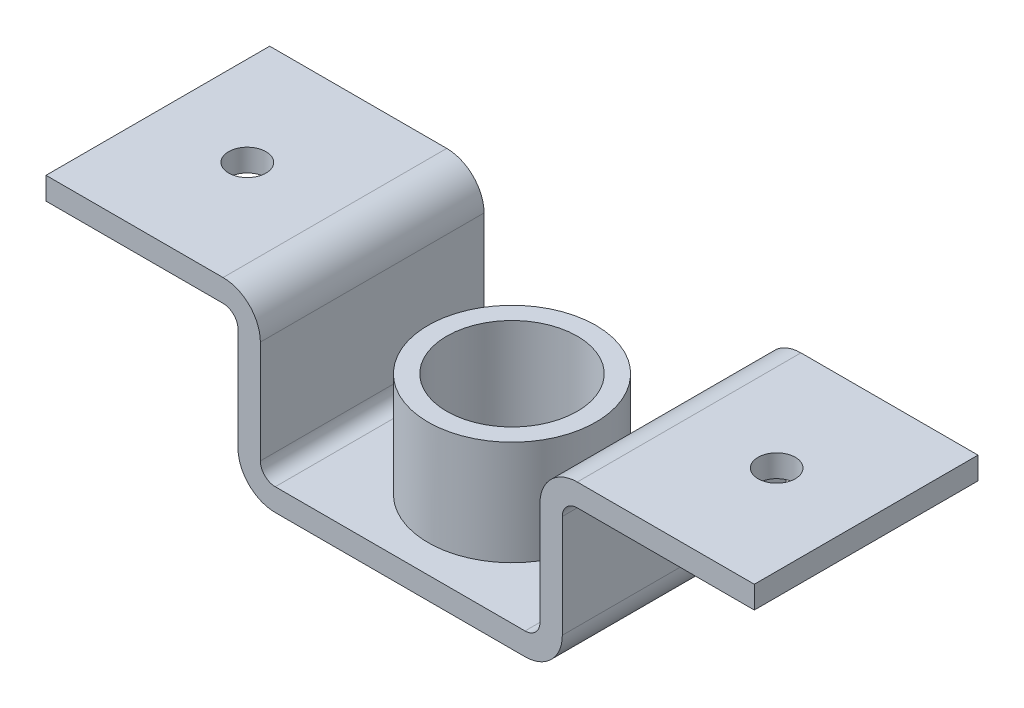
from build123d import *

# Parameters (mm, degrees)
BOSS_EXTRUDE2_DEPTH = 300
SKETCH3_R           = 112.5
SKETCH3_R_2         = 87.5
BOSS_EXTRUDE3_DEPTH = 170
SKETCH3_3_R         = 25
CUT_EXTRUDE1_DEPTH  = 238
SKETCH3_4_R         = 25
CUT_EXTRUDE2_DEPTH  = 238
SKETCH3_6_R         = 37.5
CUT_EXTRUDE4_DEPTH  = 30


with BuildPart() as part:
    # Sketch1 → Boss-Extrude2 (new body)
    with BuildSketch(Plane.XY):
        with BuildLine():
            Line((167.5, 0), (-167.5, 0))
            ThreePointArc((-167.5, 0), (-202.855339059, 14.644660941), (-217.5, 50))
            Line((-217.5, 50), (-217.5, 188))
            ThreePointArc((-217.5, 188), (-223.357864376, 202.142135624), (-237.5, 208))
            Line((-237.5, 208), (-475, 208))
            Line((-475, 208), (-475, 238))
            Line((-475, 238), (-237.5, 238))
            ThreePointArc((-237.5, 238), (-202.144660941, 223.355339059), (-187.5, 188))
            Line((-187.5, 188), (-187.5, 50))
            ThreePointArc((-187.5, 50), (-181.642135624, 35.857864376), (-167.5, 30))
            Line((-167.5, 30), (167.5, 30))
            ThreePointArc((167.5, 30), (181.642135624, 35.857864376), (187.5, 50))
            Line((187.5, 50), (187.5, 188))
            ThreePointArc((187.5, 188), (202.144660941, 223.355339059), (237.5, 238))
            Line((237.5, 238), (475, 238))
            Line((475, 238), (475, 208))
            Line((475, 208), (237.5, 208))
            ThreePointArc((237.5, 208), (223.357864376, 202.142135624), (217.5, 188))
            Line((217.5, 188), (217.5, 50))
            ThreePointArc((217.5, 50), (202.855339059, 14.644660941), (167.5, 0))
        make_face()
    extrude(amount=BOSS_EXTRUDE2_DEPTH)

    # Sketch3 → Boss-Extrude3 (add)
    with BuildSketch(Plane(origin=(0, 0, 0), x_dir=(1, 0, 0), z_dir=(0, 1, 0))):
        with Locations(Location((0, -150, 0), (0, 0, 90))):
            Circle(SKETCH3_R)
        with Locations(Location((0, -150, 0), (0, 0, 90))):
            Circle(SKETCH3_R_2, mode=Mode.SUBTRACT)
    extrude(amount=BOSS_EXTRUDE3_DEPTH)

    # Sketch3<3> → Cut-Extrude1 (cut)
    with BuildSketch(Plane(origin=(0, 0, 0), x_dir=(1, 0, 0), z_dir=(0, 1, 0))):
        with Locations(Location((-355, -150, 0), (0, 0, 90))):
            Circle(SKETCH3_3_R)
    extrude(amount=CUT_EXTRUDE1_DEPTH, mode=Mode.SUBTRACT)

    # Sketch3<4> → Cut-Extrude2 (cut)
    with BuildSketch(Plane(origin=(0, 0, 0), x_dir=(1, 0, 0), z_dir=(0, 1, 0))):
        with Locations(Location((355, -150, 0), (0, 0, 90))):
            Circle(SKETCH3_4_R)
    extrude(amount=CUT_EXTRUDE2_DEPTH, mode=Mode.SUBTRACT)

    # Sketch3<6> → Cut-Extrude4 (cut)
    with BuildSketch(Plane(origin=(0, 0, 0), x_dir=(1, 0, 0), z_dir=(0, 1, 0))):
        with Locations(Location((0, -150, 0), (0, 0, 90))):
            Circle(SKETCH3_6_R)
    extrude(amount=CUT_EXTRUDE4_DEPTH, mode=Mode.SUBTRACT)


solid = part.part
